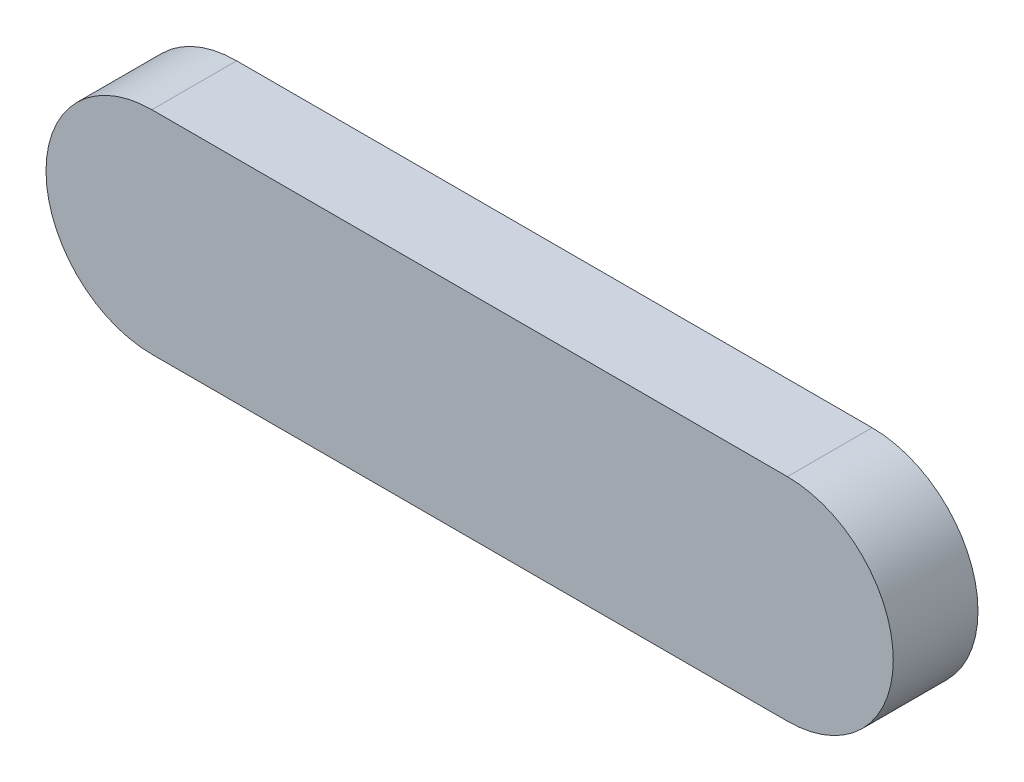
from build123d import *

# Parameters (mm, degrees)
EXTRUDE_1_DEPTH = 20


with BuildPart() as part:
    # 草图1 → 凸台-拉伸1 (new body)
    with BuildSketch(Plane.XY):
        with BuildLine():
            Line((0, 25), (150, 25))
            ThreePointArc((150, 25), (175, 0), (150, -25))
            Line((150, -25), (0, -25))
            ThreePointArc((0, -25), (-25, 0), (0, 25))
        make_face()
    extrude(amount=EXTRUDE_1_DEPTH)


solid = part.part
